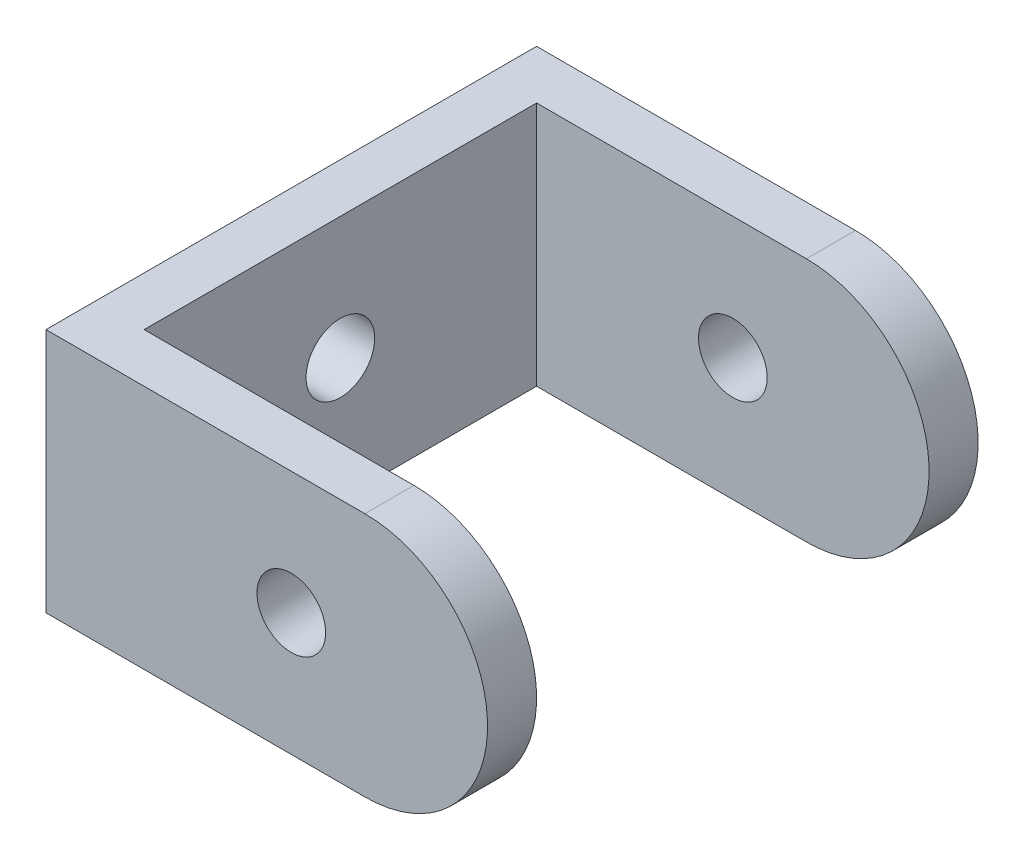
from build123d import *

# Parameters (mm, degrees)
SKETCH1_W           = 50
SKETCH1_H           = 50
SKETCH1_W_2         = 40
SKETCH1_H_2         = 40
BOSS_EXTRUDE1_DEPTH = 25
SKETCH2_R           = 3.5
CUT_EXTRUDE1_DEPTH  = 55
SKETCH3_R           = 3.5
CUT_EXTRUDE2_DEPTH  = 55
CUT_EXTRUDE3_DEPTH  = 62.23724357


with BuildPart() as part:
    # Sketch1 → Boss-Extrude1 (new body)
    with BuildSketch(Plane(origin=(0, 0, 0), x_dir=(1, 0, 0), z_dir=(0, 1, 0))):
        Rectangle(SKETCH1_W, SKETCH1_H)
        Rectangle(SKETCH1_W_2, SKETCH1_H_2, mode=Mode.SUBTRACT)
    extrude(amount=BOSS_EXTRUDE1_DEPTH)

    # Sketch2 → Cut-Extrude1 (cut)
    with BuildSketch(Plane(origin=(25, 0, 0), x_dir=(0, 0, -1), z_dir=(1, 0, 0))):
        with Locations((0, 12.5)):
            Circle(SKETCH2_R)
    extrude(amount=-CUT_EXTRUDE1_DEPTH, mode=Mode.SUBTRACT)

    # Sketch3 → Cut-Extrude2 (cut)
    with BuildSketch(Plane.XY.offset(25)):
        with Locations((0, 12.5)):
            Circle(SKETCH3_R)
    extrude(amount=-CUT_EXTRUDE2_DEPTH, mode=Mode.SUBTRACT)

    # Sketch4 → Cut-Extrude3 (cut, through all)
    with BuildSketch(Plane.XY.offset(25)):
        with BuildLine():
            Line((7.5, 25), (25, 25))
            Line((25, 25), (25, 0))
            Line((25, 0), (7.5, 0))
            ThreePointArc((7.5, 0), (20, 12.5), (7.5, 25))
        make_face()
    extrude(amount=-CUT_EXTRUDE3_DEPTH, mode=Mode.SUBTRACT)


solid = part.part
